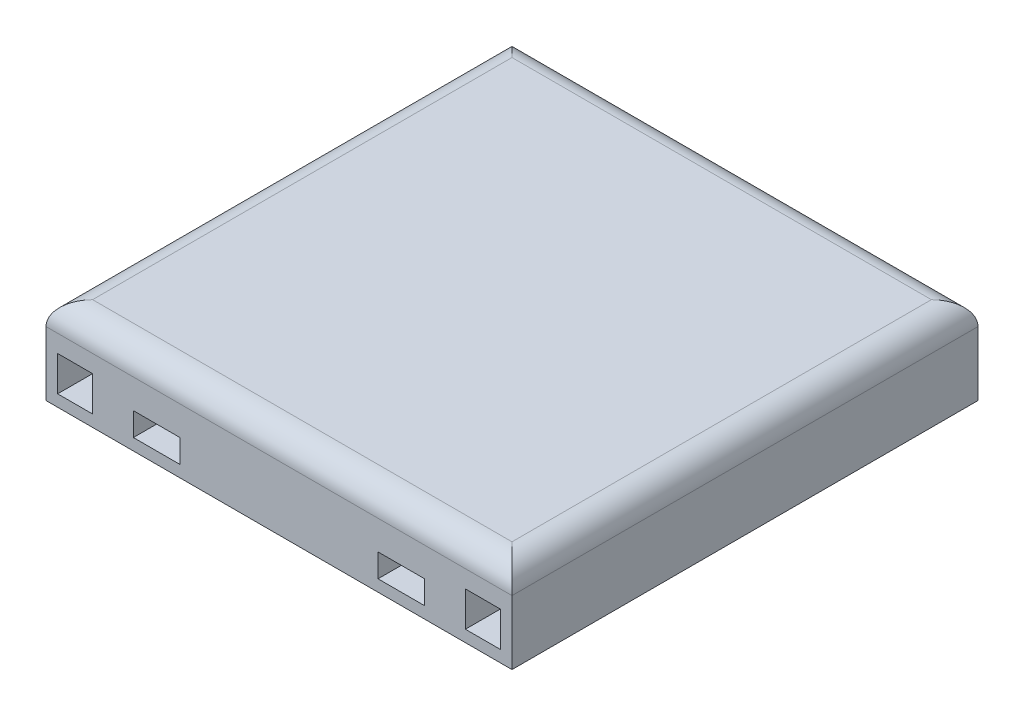
from build123d import *

# Parameters (mm, degrees)
SKETCH_1_W          = 80
SKETCH_1_H          = 80
EXTRUDE_1_DEPTH     = 7.5
FILLET_1_R          = 4
SKETCH_2_W          = 6
SKETCH_2_H          = 6
SKETCH_2_W_2        = 8
SKETCH_2_H_2        = 4
CUT_EXTRUDE_1_DEPTH = 8


with BuildPart() as part:
    # 草图1 → 凸台-拉伸1 (new, symmetric)
    with BuildSketch(Plane(origin=(0, 0, 0), x_dir=(1, 0, 0), z_dir=(0, 1, 0))):
        Rectangle(SKETCH_1_W, SKETCH_1_H)
    extrude(amount=EXTRUDE_1_DEPTH, both=True)

    # 圆角1
    fillet_1_edges = [part.edges().sort_by_distance(p)[0] for p in [
        (-40, 7.5, 0),
        (0, 7.5, 40),
        (40, 7.5, 0),
        (0, 7.5, -40),
    ]]
    fillet(fillet_1_edges, radius=FILLET_1_R)

    # 草图2 → 切除-拉伸1 (cut)
    with BuildSketch(Plane.XY.offset(40)):
        with Locations((-35, -2.5)):
            Rectangle(SKETCH_2_W, SKETCH_2_H)
        with Locations((-21, -3.5)):
            Rectangle(SKETCH_2_W_2, SKETCH_2_H_2)
        with Locations((21, -3.5)):
            Rectangle(SKETCH_2_W_2, SKETCH_2_H_2)
        with Locations((35, -2.5)):
            Rectangle(SKETCH_2_W, SKETCH_2_H)
    extrude(amount=-CUT_EXTRUDE_1_DEPTH, mode=Mode.SUBTRACT)


solid = part.part
